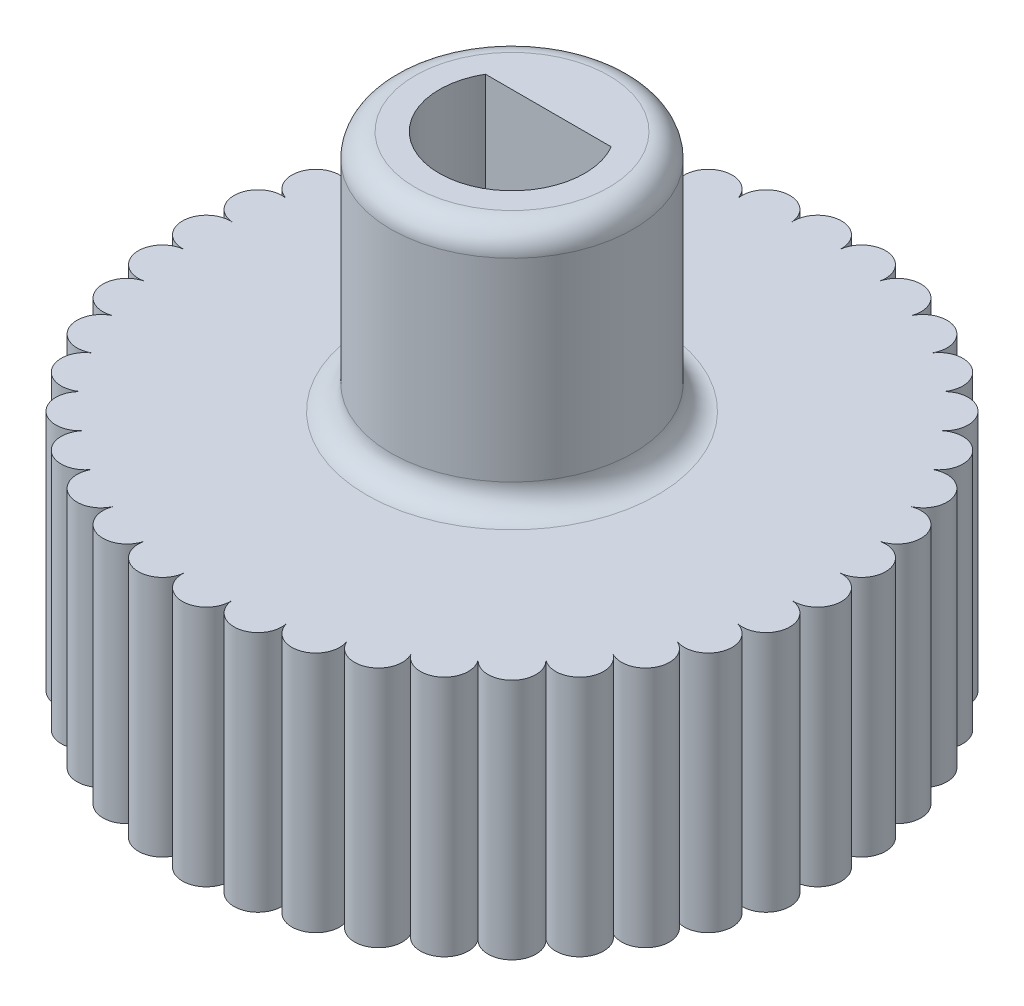
from build123d import *

# Parameters (mm, degrees)
BOSS_EXTRUDE2_DEPTH = 10
SKETCH2_R           = 5
BOSS_EXTRUDE3_DEPTH = 10
FILLET5_R           = 1
FILLET7_R           = 1


with BuildPart() as part:
    # Sketch1 → Boss-Extrude2 (new body)
    with BuildSketch(Plane(origin=(0, 0, 0), x_dir=(1, 0, 0), z_dir=(0, 1, 0))):
        with BuildLine():
            ThreePointArc((0.986735573, 12.537664208), (0, 13.605108736), (-0.986735573, 12.537664208))
            ThreePointArc((-0.986735573, 12.537664208), (-2.128307907, 13.437607271), (-2.935910014, 12.228945305))
            ThreePointArc((-2.935910014, 12.228945305), (-4.20420981, 12.939227319), (-4.812792606, 11.619109183))
            ThreePointArc((-4.812792606, 11.619109183), (-6.176590114, 12.122240646), (-6.571168272, 10.723172031))
            ThreePointArc((-6.571168272, 10.723172031), (-7.996882271, 11.006764178), (-8.167739967, 9.563194796))
            ThreePointArc((-8.167739967, 9.563194796), (-9.620264646, 9.620264646), (-9.563194796, 8.167739967))
            ThreePointArc((-9.563194796, 8.167739967), (-11.006764178, 7.996882271), (-10.723172031, 6.571168272))
            ThreePointArc((-10.723172031, 6.571168272), (-12.122240646, 6.176590114), (-11.619109183, 4.812792606))
            ThreePointArc((-11.619109183, 4.812792606), (-12.939227319, 4.20420981), (-12.228945305, 2.935910014))
            ThreePointArc((-12.228945305, 2.935910014), (-13.437607271, 2.128307907), (-12.537664208, 0.986735573))
            ThreePointArc((-12.537664208, 0.986735573), (-13.605108736, 0), (-12.537664208, -0.986735573))
            ThreePointArc((-12.537664208, -0.986735573), (-13.437607271, -2.128307907), (-12.228945305, -2.935910014))
            ThreePointArc((-12.228945305, -2.935910014), (-12.939227319, -4.20420981), (-11.619109183, -4.812792606))
            ThreePointArc((-11.619109183, -4.812792606), (-12.122240646, -6.176590114), (-10.723172031, -6.571168272))
            ThreePointArc((-10.723172031, -6.571168272), (-11.006764178, -7.996882271), (-9.563194796, -8.167739967))
            ThreePointArc((-9.563194796, -8.167739967), (-9.620264646, -9.620264646), (-8.167739967, -9.563194796))
            ThreePointArc((-8.167739967, -9.563194796), (-7.996882271, -11.006764178), (-6.571168272, -10.723172031))
            ThreePointArc((-6.571168272, -10.723172031), (-6.176590114, -12.122240646), (-4.812792606, -11.619109183))
            ThreePointArc((-4.812792606, -11.619109183), (-4.20420981, -12.939227319), (-2.935910014, -12.228945305))
            ThreePointArc((-2.935910014, -12.228945305), (-2.128307907, -13.437607271), (-0.986735573, -12.537664208))
            ThreePointArc((-0.986735573, -12.537664208), (0, -13.605108736), (0.986735573, -12.537664208))
            ThreePointArc((0.986735573, -12.537664208), (2.128307907, -13.437607271), (2.935910014, -12.228945305))
            ThreePointArc((2.935910014, -12.228945305), (4.20420981, -12.939227319), (4.812792606, -11.619109183))
            ThreePointArc((4.812792606, -11.619109183), (6.176590114, -12.122240646), (6.571168272, -10.723172031))
            ThreePointArc((6.571168272, -10.723172031), (7.996882271, -11.006764178), (8.167739967, -9.563194796))
            ThreePointArc((8.167739967, -9.563194796), (9.620264646, -9.620264646), (9.563194796, -8.167739967))
            ThreePointArc((9.563194796, -8.167739967), (11.006764178, -7.996882271), (10.723172031, -6.571168272))
            ThreePointArc((10.723172031, -6.571168272), (12.122240646, -6.176590114), (11.619109183, -4.812792606))
            ThreePointArc((11.619109183, -4.812792606), (12.939227319, -4.20420981), (12.228945305, -2.935910014))
            ThreePointArc((12.228945305, -2.935910014), (13.437607271, -2.128307907), (12.537664208, -0.986735573))
            ThreePointArc((12.537664208, -0.986735573), (13.605108736, 0), (12.537664208, 0.986735573))
            ThreePointArc((12.537664208, 0.986735573), (13.437607271, 2.128307907), (12.228945305, 2.935910014))
            ThreePointArc((12.228945305, 2.935910014), (12.939227319, 4.20420981), (11.619109183, 4.812792606))
            ThreePointArc((11.619109183, 4.812792606), (12.122240646, 6.176590114), (10.723172031, 6.571168272))
            ThreePointArc((10.723172031, 6.571168272), (11.006764178, 7.996882271), (9.563194796, 8.167739967))
            ThreePointArc((9.563194796, 8.167739967), (9.620264646, 9.620264646), (8.167739967, 9.563194796))
            ThreePointArc((8.167739967, 9.563194796), (7.996882271, 11.006764178), (6.571168272, 10.723172031))
            ThreePointArc((6.571168272, 10.723172031), (6.176590114, 12.122240646), (4.812792606, 11.619109183))
            ThreePointArc((4.812792606, 11.619109183), (4.20420981, 12.939227319), (2.935910014, 12.228945305))
            ThreePointArc((2.935910014, 12.228945305), (2.128307907, 13.437607271), (0.986735573, 12.537664208))
        make_face()
    extrude(amount=BOSS_EXTRUDE2_DEPTH)

    # Sketch2 → Boss-Extrude3 (add)
    with BuildSketch(Plane(origin=(0, 10, 0), x_dir=(1, 0, 0), z_dir=(0, 1, 0))):
        with Locations(Location((0, 0, 0), (0, 0, 270))):
            Circle(SKETCH2_R)
        with BuildLine():
            Line((-2.598076211, 1.5), (2.598076211, 1.5))
            ThreePointArc((2.598076211, 1.5), (0, -3), (-2.598076211, 1.5))
        make_face(mode=Mode.SUBTRACT)
    extrude(amount=BOSS_EXTRUDE3_DEPTH)

    # Fillet5
    fillet5_edges = [part.edges().sort_by_distance(p)[0] for p in [
        (0, 20, -5),
    ]]
    fillet(fillet5_edges, radius=FILLET5_R)

    # Fillet7
    fillet7_edges = [part.edges().sort_by_distance(p)[0] for p in [
        (0, 10, -5),
    ]]
    fillet(fillet7_edges, radius=FILLET7_R)


solid = part.part
